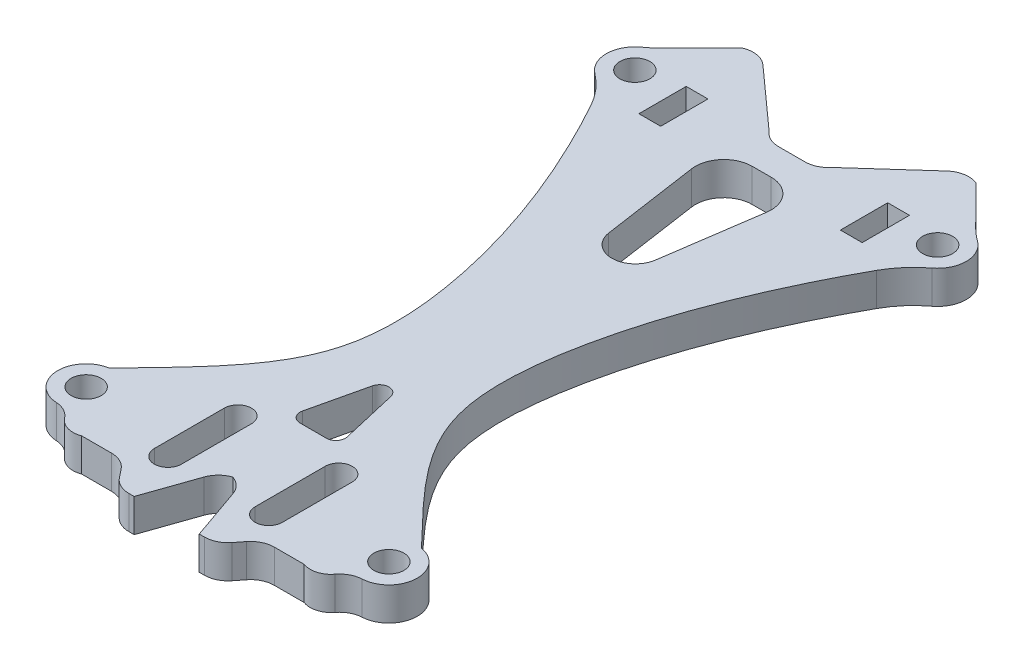
from build123d import *

# Parameters (mm, degrees)
CROQUIS1_R              = 1.5875
CROQUIS1_W              = 2.3
CROQUIS1_H              = 5
SALIENTE_EXTRUIR1_DEPTH = 3.5


with BuildPart() as part:
    # Croquis1 → Saliente-Extruir1 (new body)
    with BuildSketch(Plane(origin=(0, 0, 0), x_dir=(1, 0, 0), z_dir=(0, 1, 0))):
        with BuildLine():
            Line((-15.874295221, 31.874668373), (-11.754060701, 36.031005585))
            ThreePointArc((-11.754060701, 36.031005585), (-10.369805081, 36.191711772), (-9.114574915, 35.586412398))
            Line((-9.114574915, 35.586412398), (-2.716116368, 29.839829039))
            ThreePointArc((-2.716116368, 29.839829039), (-1.851993104, 29.164348948), (-0.781901657, 28.923752474))
            Line((-0.781901657, 28.923752474), (0.565649151, 28.923752474))
            Line((0.565649151, 28.923752474), (0.647095514, 28.923752474))
            Line((0.647095514, 28.923752474), (1.994646322, 28.923752474))
            ThreePointArc((1.994646322, 28.923752474), (3.06473777, 29.164348948), (3.928861034, 29.839829039))
            Line((3.928861034, 29.839829039), (10.327319581, 35.586412398))
            ThreePointArc((10.327319581, 35.586412398), (11.582549747, 36.191711772), (12.966805367, 36.031005585))
            Line((12.966805367, 36.031005585), (17.087039886, 31.874668373))
            ThreePointArc((17.087039886, 31.874668373), (17.703192062, 31.303268278), (18.365142407, 30.785616548))
            ThreePointArc((18.365142407, 30.785616548), (19.626123842, 28.369336027), (18.427544181, 25.921501773))
            ThreePointArc((18.427544181, 25.921501773), (16.902388008, 24.495249114), (15.706675307, 22.783358599))
            add(Edge.make_bspline(
                [(17.08637633, -26.708053998), (12.010093305, -21.41999504), (5.252678849, -14.724182661), (6.940083791, 4.589437635), (12.242427811, 16.518318459), (15.706675307, 22.783358599)],
                knots=[0, 0, 0, 0, 0.308743397, 0.525126437, 0.93919625, 0.93919625, 0.93919625, 0.93919625], degree=3))
            ThreePointArc((17.08637633, -26.708053998), (19.60196336, -29.831990985), (16.763044461, -32.665310574))
            ThreePointArc((16.763044461, -32.665310574), (15.724835901, -32.951926252), (14.903555585, -33.648721922))
            ThreePointArc((14.903555585, -33.648721922), (13.755521453, -34.435837646), (12.364591814, -34.382468459))
            Line((12.364591814, -34.382468459), (9.205112275, -34.382468459))
            ThreePointArc((9.205112275, -34.382468459), (8.113093326, -34.633581042), (7.240450136, -35.336472768))
            Line((7.240450136, -35.336472768), (6.559598907, -36.201703273))
            ThreePointArc((6.559598907, -36.201703273), (5.686955717, -36.904594998), (4.594936767, -37.155707581))
            Line((4.594936767, -37.155707581), (4.047588743, -37.155707581))
            Line((4.047588743, -37.155707581), (2.140229158, -31.696312325))
            ThreePointArc((2.140229158, -31.696312325), (1.548523338, -30.753735958), (0.606372333, -30.161353086))
            ThreePointArc((0.606372333, -30.161353086), (-0.335778672, -30.753735958), (-0.927484492, -31.696312325))
            Line((-0.927484492, -31.696312325), (-2.834844078, -37.155707581))
            Line((-2.834844078, -37.155707581), (-3.382192102, -37.155707581))
            ThreePointArc((-3.382192102, -37.155707581), (-4.474211051, -36.904594998), (-5.346854241, -36.201703273))
            Line((-5.346854241, -36.201703273), (-6.02770547, -35.336472768))
            ThreePointArc((-6.02770547, -35.336472768), (-6.90034866, -34.633581042), (-7.99236761, -34.382468459))
            Line((-7.99236761, -34.382468459), (-11.151847148, -34.382468459))
            ThreePointArc((-11.151847148, -34.382468459), (-12.542776787, -34.435837646), (-13.690810919, -33.648721922))
            ThreePointArc((-13.690810919, -33.648721922), (-14.512091235, -32.951926252), (-15.550299796, -32.665310574))
            ThreePointArc((-15.550299796, -32.665310574), (-18.389218694, -29.831990985), (-15.873631664, -26.708053998))
            add(Edge.make_bspline(
                [(-15.873631664, -26.708053998), (-10.797348639, -21.41999504), (-4.039934183, -14.724182661), (-5.727339125, 4.589437635), (-11.029683145, 16.518318459), (-14.493930641, 22.783358599)],
                knots=[0, 0, 0, 0, 0.308743397, 0.525126437, 0.93919625, 0.93919625, 0.93919625, 0.93919625], degree=3))
            ThreePointArc((-14.493930641, 22.783358599), (-15.689643342, 24.495249114), (-17.214799516, 25.921501773))
            ThreePointArc((-17.214799516, 25.921501773), (-18.413379177, 28.369336027), (-17.152397742, 30.785616548))
            ThreePointArc((-17.152397742, 30.785616548), (-16.490447396, 31.303268278), (-15.874295221, 31.874668373))
        make_face()
        with Locations(Location((16.606372333, -29.669404393, 0), (0, 0, 270))):
            Circle(CROQUIS1_R, mode=Mode.SUBTRACT)
        with Locations(Location((-15.393627667, 28.330595607, 0), (0, 0, 270))):
            Circle(CROQUIS1_R, mode=Mode.SUBTRACT)
        with Locations(Location((16.606372333, 28.330595607, 0), (0, 0, 270))):
            Circle(CROQUIS1_R, mode=Mode.SUBTRACT)
        with Locations(Location((-15.393627667, -29.669404393, 0), (0, 0, 270))):
            Circle(CROQUIS1_R, mode=Mode.SUBTRACT)
        with BuildLine():
            Line((-3.287471504, -24.301852689), (-3.287471504, -31.696312325))
            ThreePointArc((-3.287471504, -31.696312325), (-4.722504291, -33.131345111), (-6.157537077, -31.696312325))
            Line((-6.157537077, -31.696312325), (-6.157537077, -24.301852689))
            ThreePointArc((-6.157537077, -24.301852689), (-4.722504291, -22.866819903), (-3.287471504, -24.301852689))
        make_face(mode=Mode.SUBTRACT)
        with BuildLine():
            Line((-0.787449287, -21.665575324), (2.000193952, -21.665575324))
            ThreePointArc((2.000193952, -21.665575324), (2.783225968, -21.287556725), (2.974256652, -20.439297049))
            Line((2.974256652, -20.439297049), (1.580435032, -14.439297049))
            ThreePointArc((1.580435032, -14.439297049), (0.606372333, -13.665575324), (-0.367690367, -14.439297049))
            Line((-0.367690367, -14.439297049), (-1.761511986, -20.439297049))
            ThreePointArc((-1.761511986, -20.439297049), (-1.570481302, -21.287556725), (-0.787449287, -21.665575324))
        make_face(mode=Mode.SUBTRACT)
        with BuildLine():
            Line((4.50021617, -24.301852689), (4.50021617, -31.696312325))
            ThreePointArc((4.50021617, -31.696312325), (5.935248956, -33.131345111), (7.370281743, -31.696312325))
            Line((7.370281743, -31.696312325), (7.370281743, -24.301852689))
            ThreePointArc((7.370281743, -24.301852689), (5.935248956, -22.866819903), (4.50021617, -24.301852689))
        make_face(mode=Mode.SUBTRACT)
        with BuildLine():
            Line((-0.39543432, 25.732977828), (1.608178986, 25.732977828))
            ThreePointArc((1.608178986, 25.732977828), (3.877356766, 24.695331568), (4.576798655, 22.300199296))
            Line((4.576798655, 22.300199296), (3.080222057, 12.034517445))
            ThreePointArc((3.080222057, 12.034517445), (0.606372333, 9.895166222), (-1.867477392, 12.034517445))
            Line((-1.867477392, 12.034517445), (-3.364053989, 22.300199296))
            ThreePointArc((-3.364053989, 22.300199296), (-2.6646121, 24.695331568), (-0.39543432, 25.732977828))
        make_face(mode=Mode.SUBTRACT)
        with Locations((-10.043627667, 27.05538099)):
            Rectangle(CROQUIS1_W, CROQUIS1_H, mode=Mode.SUBTRACT)
        with Locations((11.256372333, 27.05538099)):
            Rectangle(CROQUIS1_W, CROQUIS1_H, mode=Mode.SUBTRACT)
    extrude(amount=SALIENTE_EXTRUIR1_DEPTH)


solid = part.part
